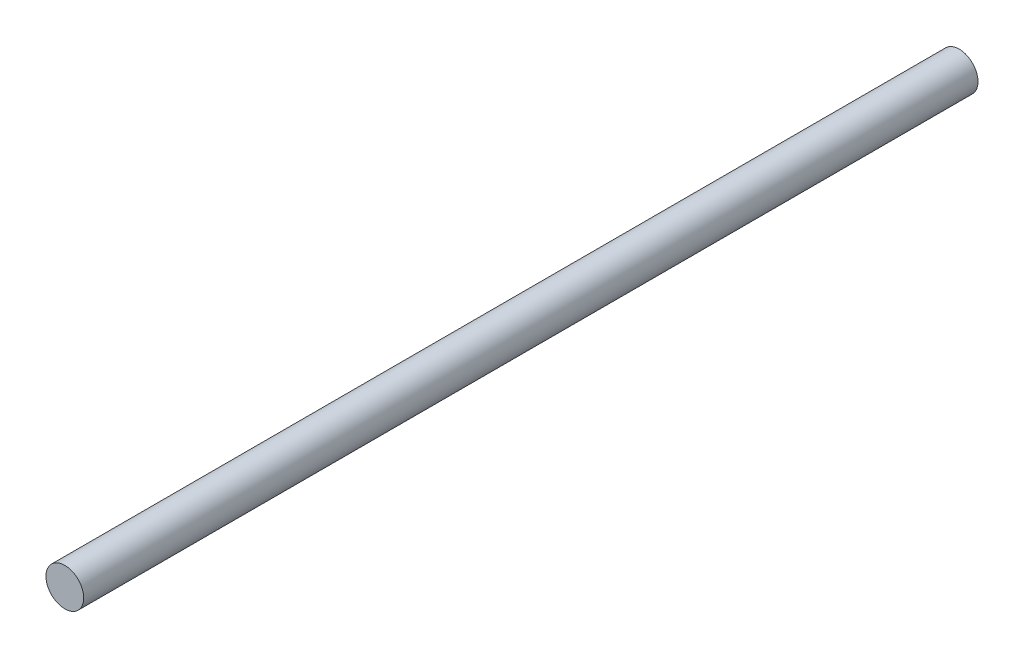
from build123d import *

# Parameters (mm, degrees)
SZKIC1_R                    = 5
DODANIE_WYCI_GNI_CIE1_DEPTH = 237


with BuildPart() as part:
    # Szkic1 → Dodanie-wyciągnięcie1 (new body)
    with BuildSketch(Plane.XY):
        Circle(SZKIC1_R)
    extrude(amount=DODANIE_WYCI_GNI_CIE1_DEPTH)


solid = part.part
